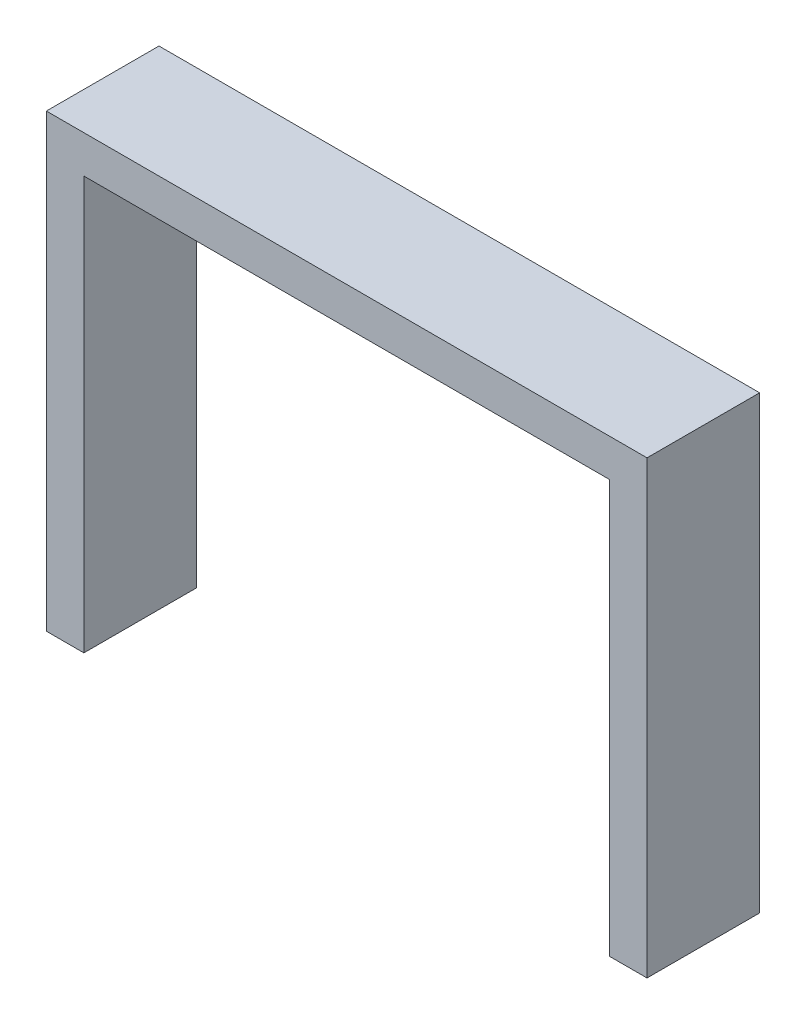
from build123d import *

# Parameters (mm, degrees)
BOSS_EXTRUDE1_DEPTH = 15
SCALE1_SCALE        = 0.7


with BuildPart() as part:
    # Sketch2 → Boss-Extrude1 (new body)
    with BuildSketch(Plane(origin=(0, 0, 0), x_dir=(0, 1, 0), z_dir=(0, 0, 1))):
        Polygon((-30, -35), (-30, -40), (30, -40), (30, 40), (-30, 40), (-30, 35), (25, 35), (25, -35), align=None)
    extrude(amount=-BOSS_EXTRUDE1_DEPTH)


with BuildPart() as part_1:
    # Scale1: scaled about (0, 10.131578947, -7.5)
    add(part.part.scale(SCALE1_SCALE).moved(Location((0, 3.039473684, -2.25))))


solid = part_1.part
